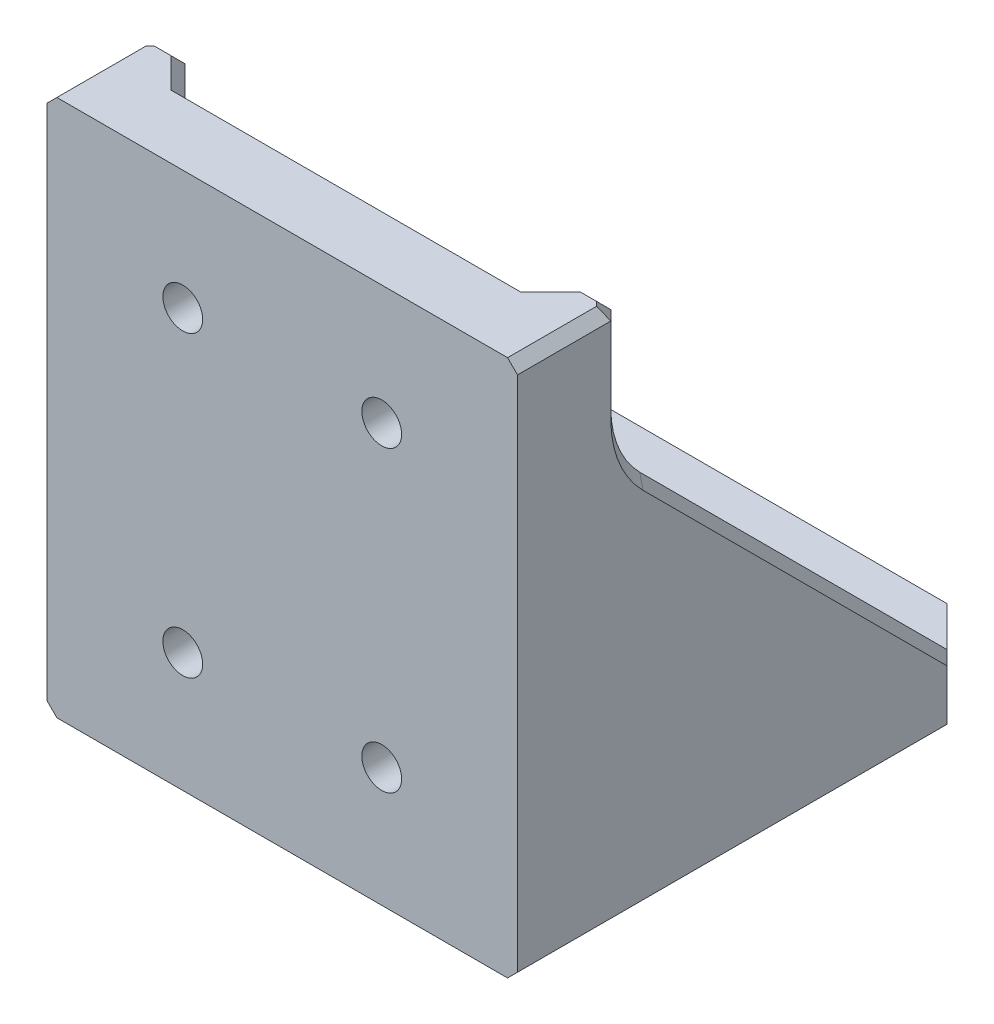
from build123d import *

# Parameters (mm, degrees)
SKETCH1_R               = 1.5
SKETCH1_R_2             = 11.5
BOSS_EXTRUDE1_DEPTH     = 5
BOSS_EXTRUDE2_DEPTH     = 54
CUT_EXTRUDE1_DEPTH      = 64.518855468
CUT_EXTRUDE1_DEPTH_BACK = 64.518855468
FILLET1_R               = 10
BOSS_EXTRUDE3_DEPTH     = 51
CHAMFER2_SIZE           = 1
BOSS_EXTRUDE4_DEPTH     = 54
CHAMFER3_SIZE           = 1
CHAMFER4_SIZE           = 1
CHAMFER5_SIZE           = 1
SKETCH11_R              = 4
CUT_EXTRUDE2_DEPTH      = 3
SKETCH12_R              = 2
CUT_EXTRUDE3_DEPTH      = 73.557649493
CHAMFER6_SIZE           = 1


with BuildPart() as part:
    # Sketch1 → Boss-Extrude1 (new body)
    with BuildSketch(Plane(origin=(0, 0, 0), x_dir=(1, 0, 0), z_dir=(0, 1, 0))):
        Polygon((-21.15, 17.15), (-17.15, 21.15), (17.15, 21.15), (21.15, 17.15), (21.15, -17.15), (17.15, -21.15), (-17.15, -21.15), (-21.15, -17.15), align=None)
        with Locations(Location((-15.5, 15.5, 0), (0, 0, 270))):
            Circle(SKETCH1_R, mode=Mode.SUBTRACT)
        with Locations(Location((15.5, 15.5, 0), (0, 0, 270))):
            Circle(SKETCH1_R, mode=Mode.SUBTRACT)
        with Locations(Location((15.5, -15.5, 0), (0, 0, 270))):
            Circle(SKETCH1_R, mode=Mode.SUBTRACT)
        with Locations(Location((-15.5, -15.5, 0), (0, 0, 270))):
            Circle(SKETCH1_R, mode=Mode.SUBTRACT)
        with Locations(Location((0, 0, 0), (0, 0, 270))):
            Circle(SKETCH1_R_2, mode=Mode.SUBTRACT)
    extrude(amount=BOSS_EXTRUDE1_DEPTH)

    # Sketch5 → Boss-Extrude2 (add)
    with BuildSketch(Plane(origin=(0, 0, 0), x_dir=(1, 0, 0), z_dir=(0, 1, 0))):
        Polygon((-23.65, 14.65), (-23.65, -18.185533906), (-18.185533906, -23.65), (18.185533906, -23.65), (23.65, -18.185533906), (23.65, 14.65), (21.15, 17.15), (21.15, -17.15), (17.15, -21.15), (-17.15, -21.15), (-21.15, -17.15), (-21.15, 17.15), align=None)
    extrude(amount=BOSS_EXTRUDE2_DEPTH)

    # Sketch6 → Cut-Extrude1 (cut, two sides: drawn at the far end of the back side and taken through both)
    with BuildSketch(Plane(origin=(0, 0, 0), x_dir=(0, 0, -1), z_dir=(1, 0, 0)).offset(-CUT_EXTRUDE1_DEPTH_BACK)):
        Polygon((17.15, 5), (-18.15, 40.3), (-18.15, 54), (17.15, 54), align=None)
    extrude(amount=CUT_EXTRUDE1_DEPTH + CUT_EXTRUDE1_DEPTH_BACK, mode=Mode.SUBTRACT)

    # Fillet1
    fillet1_edges = [part.edges().sort_by_distance(p)[0] for p in [
        (-21.9, 40.3, 18.15),
        (21.9, 40.3, 18.15),
    ]]
    fillet(fillet1_edges, radius=FILLET1_R)

    # Sketch9 → Boss-Extrude3 (add)
    with BuildSketch(Plane(origin=(0, 0, 0), x_dir=(1, 0, 0), z_dir=(0, 1, 0))):
        Polygon((-18.185533906, -23.65), (-21, -28.524798271), (21, -28.524798271), (18.185533906, -23.65), align=None)
    extrude(amount=BOSS_EXTRUDE3_DEPTH)

    # Chamfer2
    chamfer2_edges = [part.edges().sort_by_distance(p)[0] for p in [
        (0, 0, -11.5),
    ]]
    chamfer(chamfer2_edges, length=CHAMFER2_SIZE)

    # Sketch10 → Boss-Extrude4 (add)
    with BuildSketch(Plane(origin=(0, 54, 0), x_dir=(1, 0, 0), z_dir=(0, 1, 0))):
        Polygon((-23.65, -18.15), (-20.15, -18.15), (-17.15, -21.15), (17.15, -21.15), (20.15, -18.15), (23.65, -18.15), (23.65, -28.524798271), (-23.65, -28.524798271), align=None)
    extrude(amount=-BOSS_EXTRUDE4_DEPTH)

    # Chamfer3
    chamfer3_edges = [part.edges().sort_by_distance(p)[0] for p in [
        (-23.65, 0, 6.937399136),
        (23.65, 0, 6.937399136),
        (-20.4, 0, -17.9),
        (0, 0, -21.15),
        (20.4, 0, -17.9),
    ]]
    chamfer(chamfer3_edges, length=CHAMFER3_SIZE)

    # Chamfer4
    chamfer4_edges = [part.edges().sort_by_distance(p)[0] for p in [
        (-23.65, 22.435533906, 0.285533906),
        (23.65, 22.435533906, 0.285533906),
        (-23.65, 40.6153013, 17.388795325),
        (23.65, 40.6153013, 17.388795325),
        (-23.65, 49.221067812, 18.15),
        (23.65, 49.221067812, 18.15),
    ]]
    chamfer(chamfer4_edges, length=CHAMFER4_SIZE)

    # Chamfer5
    chamfer5_edges = [part.edges().sort_by_distance(p)[0] for p in [
        (-23.65, 54, 23.837399136),
        (-21.4, 54, 18.15),
        (23.15, 54, 18.65),
        (-23.15, 54, 18.65),
        (23.65, 54, 23.837399136),
        (0, 54, 21.15),
        (-18.65, 54, 19.65),
        (18.65, 54, 19.65),
        (21.4, 54, 18.15),
    ]]
    chamfer(chamfer5_edges, length=CHAMFER5_SIZE)

    # Sketch11 → Cut-Extrude2 (cut)
    with BuildSketch(Plane(origin=(0, 0, 21.15), x_dir=(-1, 0, 0), z_dir=(0, 0, -1))):
        with Locations((-10, 42)):
            Circle(SKETCH11_R)
        with Locations((10, 42)):
            Circle(SKETCH11_R)
        with Locations((-10, 12)):
            Circle(SKETCH11_R)
        with Locations((10, 12)):
            Circle(SKETCH11_R)
    extrude(amount=-CUT_EXTRUDE2_DEPTH, mode=Mode.SUBTRACT)

    # Sketch12 → Cut-Extrude3 (cut, through all)
    with BuildSketch(Plane(origin=(0, 0, 21.15), x_dir=(-1, 0, 0), z_dir=(0, 0, -1))):
        with Locations((-10, 42)):
            Circle(SKETCH12_R)
        with Locations((10, 42)):
            Circle(SKETCH12_R)
        with Locations((-10, 12)):
            Circle(SKETCH12_R)
        with Locations((10, 12)):
            Circle(SKETCH12_R)
    extrude(amount=-CUT_EXTRUDE3_DEPTH, mode=Mode.SUBTRACT)

    # Chamfer6
    chamfer6_edges = [part.edges().sort_by_distance(p)[0] for p in [
        (-6, 42, 21.15),
        (14, 12, 21.15),
        (-6, 12, 21.15),
        (14, 42, 21.15),
    ]]
    chamfer(chamfer6_edges, length=CHAMFER6_SIZE)


solid = part.part
